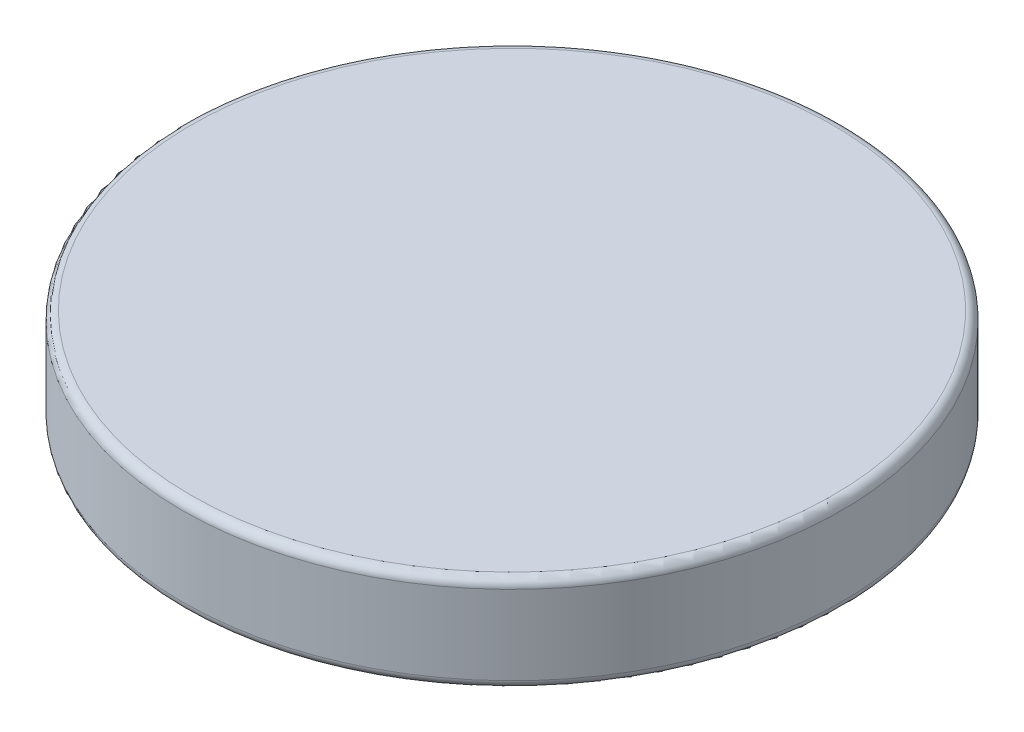
from build123d import *

# Parameters (mm, degrees)
PROFILE_R           = 3.75
CAP_DEPTH           = 1.1
PRODUCTION_FILLET_R = 0.1


with BuildPart() as part:
    # Profile → Cap (new body)
    with BuildSketch(Plane(origin=(0, 0, 0), x_dir=(1, 0, 0), z_dir=(0, 1, 0))):
        with Locations(Location((0, 0, 0), (0, 0, 270))):
            Circle(PROFILE_R)
    extrude(amount=CAP_DEPTH)

    # Production Fillet
    production_fillet_edges = [part.edges().sort_by_distance(p)[0] for p in [
        (0, 0, -3.75),
        (0, 1.1, -3.75),
    ]]
    fillet(production_fillet_edges, radius=PRODUCTION_FILLET_R)


solid = part.part
